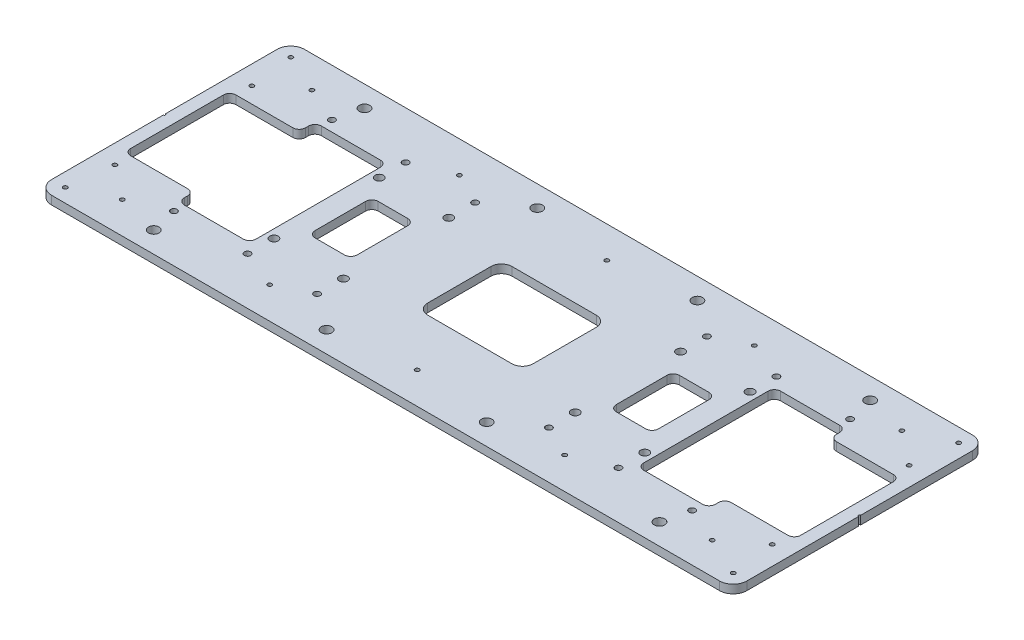
from build123d import *

# Parameters (mm, degrees)
ESQUISSE1_W             = 165
ESQUISSE1_H             = 120
BOSS_EXTRU_1_DEPTH      = 4
ESQUISSE2_R             = 2
ESQUISSE2_R_2           = 1.5
ESQUISSE2_W             = 20
ESQUISSE2_H             = 30
ENL_V_MAT_EXTRU_1_DEPTH = 176.616058491
CONG_1_R                = 3
CONG_2_R                = 6.5
ESQUISSE3_R             = 1
ENL_V_MAT_EXTRU_2_DEPTH = 176.616058491
ESQUISSE4_R             = 2.5
ESQUISSE4_R_2           = 1
ENL_V_MAT_EXTRU_3_DEPTH = 176.616058491
ESQUISSE6_R             = 0.5
ESQUISSE6_W             = 50
ESQUISSE6_H             = 40
ENL_V_MAT_EXTRU_4_DEPTH = 176.616058491
CONG_3_R                = 5


with BuildPart() as part:
    # Esquisse1 → Boss.-Extru.1 (new body)
    with BuildSketch(Plane(origin=(0, 0, 0), x_dir=(1, 0, 0), z_dir=(0, 1, 0))):
        with Locations((82.5, 0)):
            Rectangle(ESQUISSE1_W, ESQUISSE1_H)
    extrude(amount=BOSS_EXTRU_1_DEPTH)

    # Esquisse2 → Enlèv. mat.-Extru.1 (cut, through all)
    with BuildSketch(Plane(origin=(0, 4, 0), x_dir=(1, 0, 0), z_dir=(0, 1, 0))):
        with Locations(Location((55, 25, 0), (0, 0, 270))):
            Circle(ESQUISSE2_R)
        with Locations(Location((88, 25, 0), (0, 0, 270))):
            Circle(ESQUISSE2_R)
        with Locations(Location((88, -25, 0), (0, 0, 90))):
            Circle(ESQUISSE2_R)
        with Locations(Location((55, -25, 0), (0, 0, 90))):
            Circle(ESQUISSE2_R)
        with Locations(Location((55, -37.5, 0), (0, 0, 270))):
            Circle(ESQUISSE2_R_2)
        with Locations(Location((88, -37.5, 0), (0, 0, 270))):
            Circle(ESQUISSE2_R_2)
        with Locations(Location((123, -37.5, 0), (0, 0, 270))):
            Circle(ESQUISSE2_R_2)
        with Locations(Location((123, 37.5, 0), (0, 0, 90))):
            Circle(ESQUISSE2_R_2)
        with Locations(Location((88, 37.5, 0), (0, 0, 90))):
            Circle(ESQUISSE2_R_2)
        with Locations(Location((55, 37.5, 0), (0, 0, 90))):
            Circle(ESQUISSE2_R_2)
        Polygon((126, -25), (126, -32.5), (92, -32.5), (92, 32.5), (126, 32.5), (126, 25), (159, 25), (159, -25), align=None)
        with Locations((71.5, 0)):
            Rectangle(ESQUISSE2_W, ESQUISSE2_H)
    extrude(amount=-ENL_V_MAT_EXTRU_1_DEPTH, mode=Mode.SUBTRACT)

    # Congé1
    cong_1_edges = [part.edges().sort_by_distance(p)[0] for p in [
        (92, 2, 32.5),
        (92, 2, -32.5),
        (126, 2, -32.5),
        (126, 2, -25),
        (159, 2, -25),
        (159, 2, 25),
        (126, 2, 25),
        (126, 2, 32.5),
        (61.5, 2, 15),
        (61.5, 2, -15),
        (81.5, 2, -15),
        (81.5, 2, 15),
    ]]
    fillet(cong_1_edges, radius=CONG_1_R)

    # Congé2
    cong_2_edges = [part.edges().sort_by_distance(p)[0] for p in [
        (165, 2, -60),
        (165, 2, 60),
    ]]
    fillet(cong_2_edges, radius=CONG_2_R)

    # Esquisse3 → Enlèv. mat.-Extru.2 (cut, through all)
    with BuildSketch(Plane(origin=(0, 4, 0), x_dir=(1, 0, 0), z_dir=(0, 1, 0))):
        with Locations(Location((158.5, -53.5, 0), (0, 0, 270))):
            Circle(ESQUISSE3_R)
        with Locations(Location((158.5, 53.5, 0), (0, 0, 270))):
            Circle(ESQUISSE3_R)
        with Locations(Location((156, 32.5, 0), (0, 0, 270))):
            Circle(ESQUISSE3_R)
        with Locations(Location((156, -32.5, 0), (0, 0, 90))):
            Circle(ESQUISSE3_R)
    extrude(amount=-ENL_V_MAT_EXTRU_2_DEPTH, mode=Mode.SUBTRACT)

    # Esquisse4 → Enlèv. mat.-Extru.3 (cut, through all)
    with BuildSketch(Plane(origin=(0, 4, 0), x_dir=(1, 0, 0), z_dir=(0, 1, 0))):
        with Locations(Location((120, -50, 0), (0, 0, 270))):
            Circle(ESQUISSE4_R)
        with Locations(Location((38, -50, 0), (0, 0, 270))):
            Circle(ESQUISSE4_R)
        with Locations(Location((38, 50, 0), (0, 0, 90))):
            Circle(ESQUISSE4_R)
        with Locations(Location((120, 50, 0), (0, 0, 90))):
            Circle(ESQUISSE4_R)
        with Locations((0, 45)):
            Circle(ESQUISSE4_R_2)
        with Locations(Location((70, 45, 0), (0, 0, 270))):
            Circle(ESQUISSE4_R_2)
        with Locations(Location((140, 45, 0), (0, 0, 270))):
            Circle(ESQUISSE4_R_2)
        with Locations(Location((140, -45, 0), (0, 0, 90))):
            Circle(ESQUISSE4_R_2)
        with Locations(Location((70, -45, 0), (0, 0, 90))):
            Circle(ESQUISSE4_R_2)
        with Locations((0, -45)):
            Circle(ESQUISSE4_R_2)
    extrude(amount=-ENL_V_MAT_EXTRU_3_DEPTH, mode=Mode.SUBTRACT)

    # Symétrie1: part across plane


with BuildPart() as part_1:
    add(part.part)
    add(part.part.mirror(Plane(origin=(0, 4, -60), x_dir=(0, 0, 1), z_dir=(1, 0, 0))))

    # Esquisse6 → Enlèv. mat.-Extru.4 (cut, through all)
    with BuildSketch(Plane(origin=(0, 4, 0), x_dir=(1, 0, 0), z_dir=(0, 1, 0))):
        with Locations((165, 0)):
            Circle(ESQUISSE6_R)
        with Locations((-165, 0)):
            Circle(ESQUISSE6_R)
        Rectangle(ESQUISSE6_W, ESQUISSE6_H)
    extrude(amount=-ENL_V_MAT_EXTRU_4_DEPTH, mode=Mode.SUBTRACT)

    # Congé3
    cong_3_edges = [part_1.edges().sort_by_distance(p)[0] for p in [
        (25, 2, -20),
        (25, 2, 20),
        (-25, 2, 20),
        (-25, 2, -20),
    ]]
    fillet(cong_3_edges, radius=CONG_3_R)


solid = part_1.part
